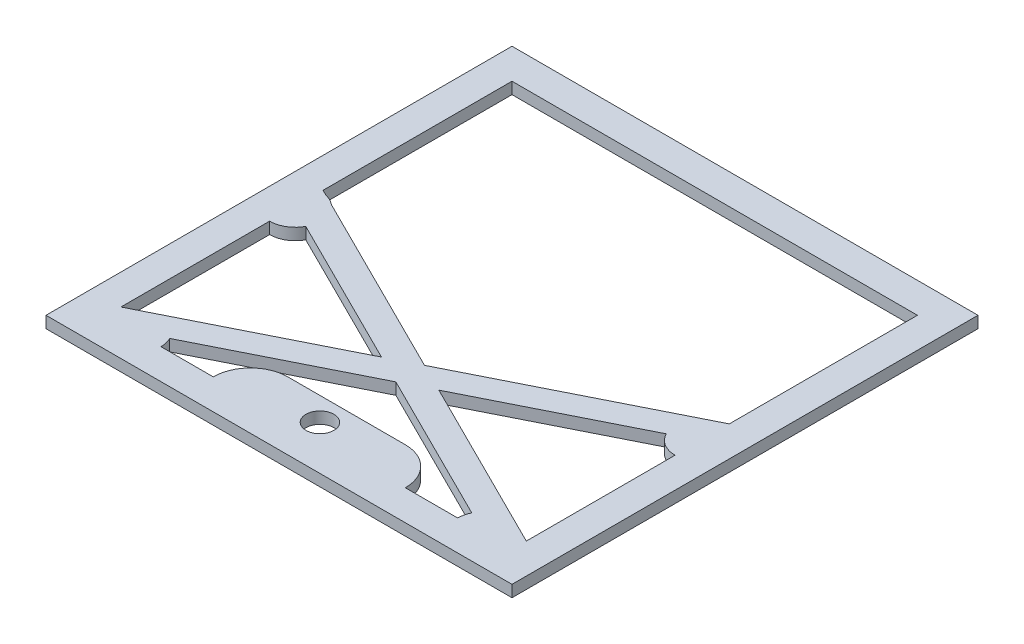
from build123d import *

# Parameters (mm, degrees)
SKETCH1_W           = 100
SKETCH1_H           = 100
SKETCH1_W_2         = 87
SKETCH1_H_2         = 87
BOSS_EXTRUDE1_DEPTH = 2.5
BOSS_EXTRUDE2_DEPTH = 2.5
SKETCH3_W           = 52.284767499
SKETCH3_H           = 7.135478262
CUT_EXTRUDE1_DEPTH  = 2.5
SKETCH4_R           = 3
CUT_EXTRUDE2_DEPTH  = 2.5
EXTRUDE_THIN2_DEPTH = 2.5
SKETCH6_R           = 5.5
BOSS_EXTRUDE3_DEPTH = 2.5


with BuildPart() as part:
    # Sketch1 → Boss-Extrude1 (new body)
    with BuildSketch(Plane(origin=(0, 0, 0), x_dir=(1, 0, 0), z_dir=(0, 1, 0))):
        Rectangle(SKETCH1_W, SKETCH1_H)
        Rectangle(SKETCH1_W_2, SKETCH1_H_2, mode=Mode.SUBTRACT)
    extrude(amount=BOSS_EXTRUDE1_DEPTH)

    # Sketch2 → Boss-Extrude2 (add)
    with BuildSketch(Plane(origin=(0, 2.5, 0), x_dir=(1, 0, 0), z_dir=(0, 1, 0))):
        with BuildLine():
            Line((-12.615137118, -35.5), (12.615137118, -35.5))
            ThreePointArc((12.615137118, -35.5), (20.615137118, -43.5), (12.615137118, -51.5))
            Line((12.615137118, -51.5), (-12.615137118, -51.5))
            ThreePointArc((-12.615137118, -51.5), (-20.615137118, -43.5), (-12.615137118, -35.5))
        make_face()
    extrude(amount=-BOSS_EXTRUDE2_DEPTH)

    # Sketch3 → Cut-Extrude1 (cut)
    with BuildSketch(Plane(origin=(0, 2.5, 0), x_dir=(1, 0, 0), z_dir=(0, 1, 0))):
        with Locations((-0.902498863, -53.567739131)):
            Rectangle(SKETCH3_W, SKETCH3_H)
    extrude(amount=-CUT_EXTRUDE1_DEPTH, mode=Mode.SUBTRACT)

    # Sketch4 → Cut-Extrude2 (cut)
    with BuildSketch(Plane(origin=(0, 2.5, 0), x_dir=(1, 0, 0), z_dir=(0, 1, 0))):
        with Locations(Location((-0.710916126, -40.5, 0), (0, 0, 270))):
            Circle(SKETCH4_R)
    extrude(amount=-CUT_EXTRUDE2_DEPTH, mode=Mode.SUBTRACT)

    # Sketch5 → Extrude-Thin2 (add)
    with BuildSketch(Plane(origin=(0, 2.5, 0), x_dir=(1, 0, 0), z_dir=(0, 1, 0))):
        Polygon((-42.268876098, -45.959031097), (48.231095848, -0.649852738), (45.768848044, 4.268209457), (-44.731123902, -41.040968903), align=None)
        Polygon((44.727203432, -41.039010009), (-46.134206752, 4.270168351), (-48.588613617, -0.651811631), (42.272796568, -45.960989991), align=None)
    extrude(amount=-EXTRUDE_THIN2_DEPTH)

    # Sketch6 → Boss-Extrude3 (add)
    with BuildSketch(Plane(origin=(0, 2.5, 0), x_dir=(1, 0, 0), z_dir=(0, 1, 0))):
        with Locations((37.337615019, -43.5)):
            Circle(SKETCH6_R)
        with Locations((43.5, -3.018495081)):
            Circle(SKETCH6_R)
        with Locations((-37.337615019, -43.5)):
            Circle(SKETCH6_R)
        with Locations((-43.5, -3.018495081)):
            Circle(SKETCH6_R)
    extrude(amount=-BOSS_EXTRUDE3_DEPTH)


solid = part.part
